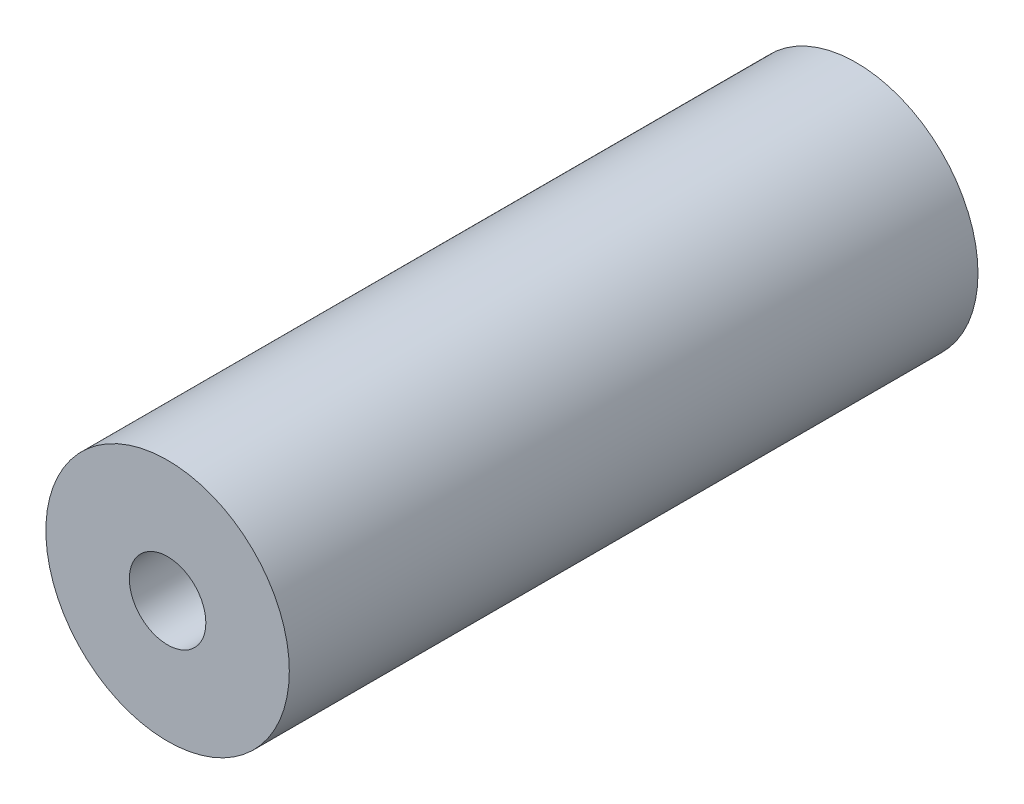
from build123d import *

# Parameters (mm, degrees)
SKETCH1_R           = 17.5
BOSS_EXTRUDE1_DEPTH = 99
SKETCH3_R           = 5.5
CUT_EXTRUDE2_DEPTH  = 103.046558002


with BuildPart() as part:
    # Sketch1 → Boss-Extrude1 (new body)
    with BuildSketch(Plane.XY):
        Circle(SKETCH1_R)
    extrude(amount=BOSS_EXTRUDE1_DEPTH)

    # Sketch3 → Cut-Extrude2 (cut, through all)
    with BuildSketch(Plane.XY.offset(99)):
        Circle(SKETCH3_R)
    extrude(amount=-CUT_EXTRUDE2_DEPTH, mode=Mode.SUBTRACT)


solid = part.part
